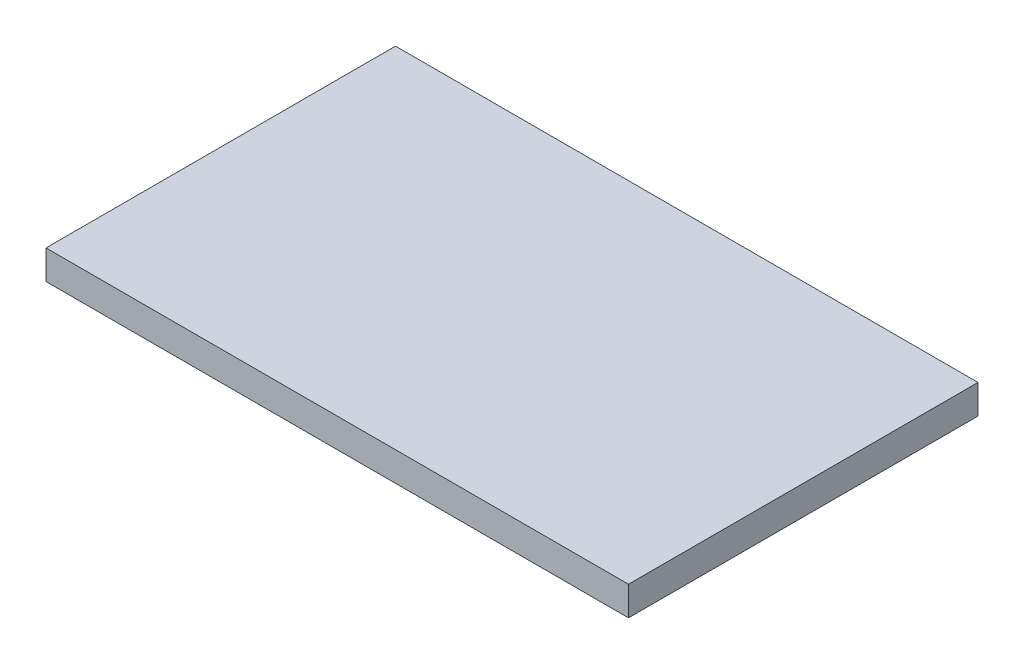
from build123d import *

# Parameters (mm, degrees)
SKETCH1_W           = 63.5
SKETCH1_H           = 38.1
BOSS_EXTRUDE1_DEPTH = 3.175


with BuildPart() as part:
    # Sketch1 → Boss-Extrude1 (new body)
    with BuildSketch(Plane(origin=(0, 0, 0), x_dir=(1, 0, 0), z_dir=(0, 1, 0))):
        Rectangle(SKETCH1_W, SKETCH1_H)
    extrude(amount=BOSS_EXTRUDE1_DEPTH)


solid = part.part
